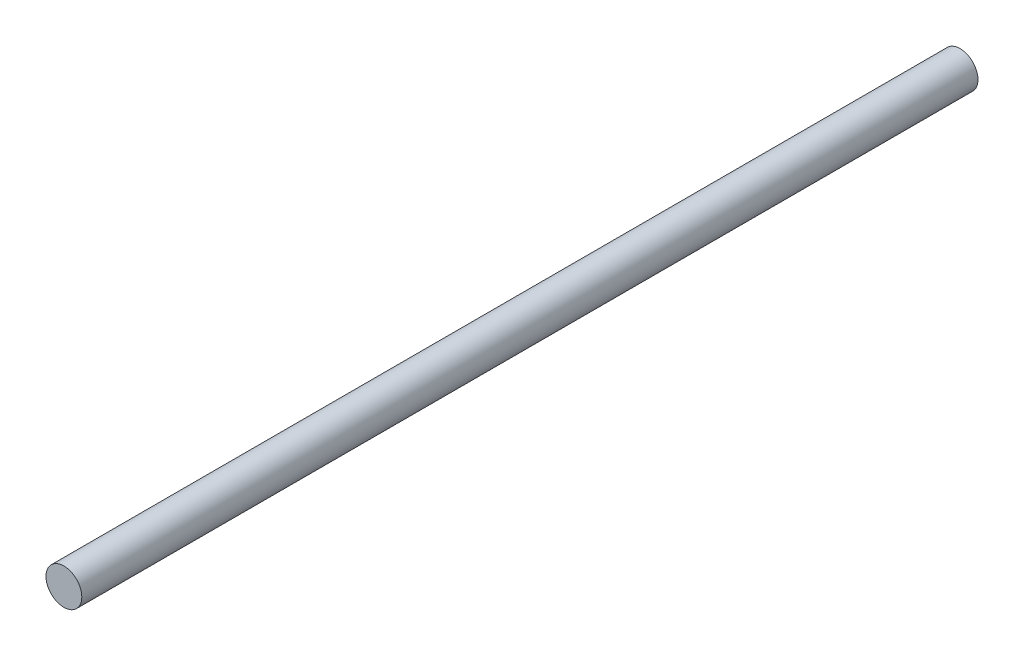
from build123d import *

# Parameters (mm, degrees)
SZKIC1_R                    = 4
DODANIE_WYCI_GNI_CIE1_DEPTH = 200


with BuildPart() as part:
    # Szkic1 → Dodanie-wyciągnięcie1 (new body)
    with BuildSketch(Plane.XY):
        Circle(SZKIC1_R)
    extrude(amount=DODANIE_WYCI_GNI_CIE1_DEPTH)


solid = part.part
